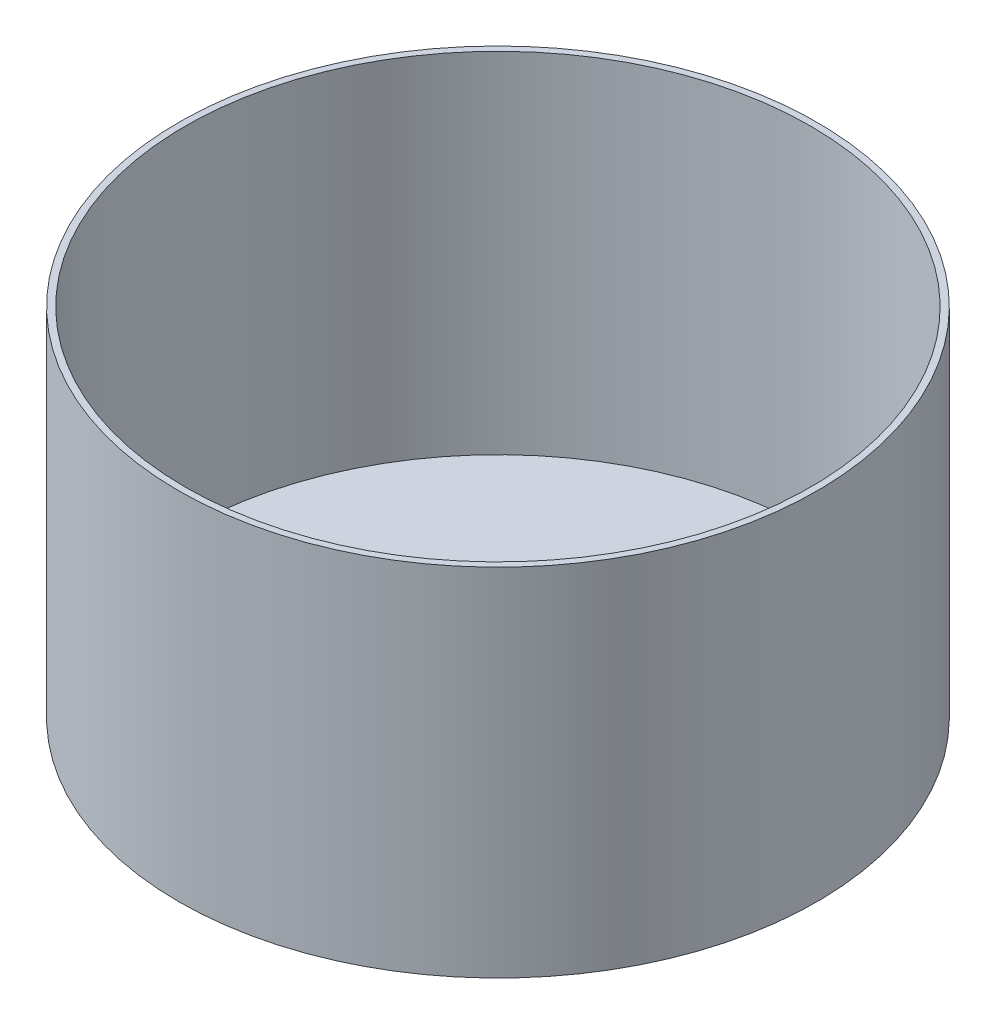
from build123d import *

# Parameters (mm, degrees)
BASKET_BASE_RING_SKETCH_R   = 148
BASKET_BASE_RING_SKETCH_R_2 = 65
BASKET_BASE_RING_DEPTH      = 3
BASKET_WALL_SKETCH_R        = 148
BASKET_WALL_SKETCH_R_2      = 145
BASKET_WALL_DEPTH           = 165


with BuildPart() as part:
    # Basket Base Ring Sketch → Basket Base Ring (new body)
    with BuildSketch(Plane(origin=(0, 0, 0), x_dir=(1, 0, 0), z_dir=(0, 1, 0))):
        with Locations(Location((0, 0, 0), (0, 0, 270))):
            Circle(BASKET_BASE_RING_SKETCH_R)
        with Locations(Location((0, 0, 0), (0, 0, 270))):
            Circle(BASKET_BASE_RING_SKETCH_R_2, mode=Mode.SUBTRACT)
    extrude(amount=BASKET_BASE_RING_DEPTH)

    # Basket Wall Sketch → Basket Wall (add)
    with BuildSketch(Plane(origin=(0, 0, 0), x_dir=(1, 0, 0), z_dir=(0, 1, 0))):
        with Locations(Location((0, 0, 0), (0, 0, 270))):
            Circle(BASKET_WALL_SKETCH_R)
        with Locations(Location((0, 0, 0), (0, 0, 270))):
            Circle(BASKET_WALL_SKETCH_R_2, mode=Mode.SUBTRACT)
    extrude(amount=BASKET_WALL_DEPTH)


solid = part.part
